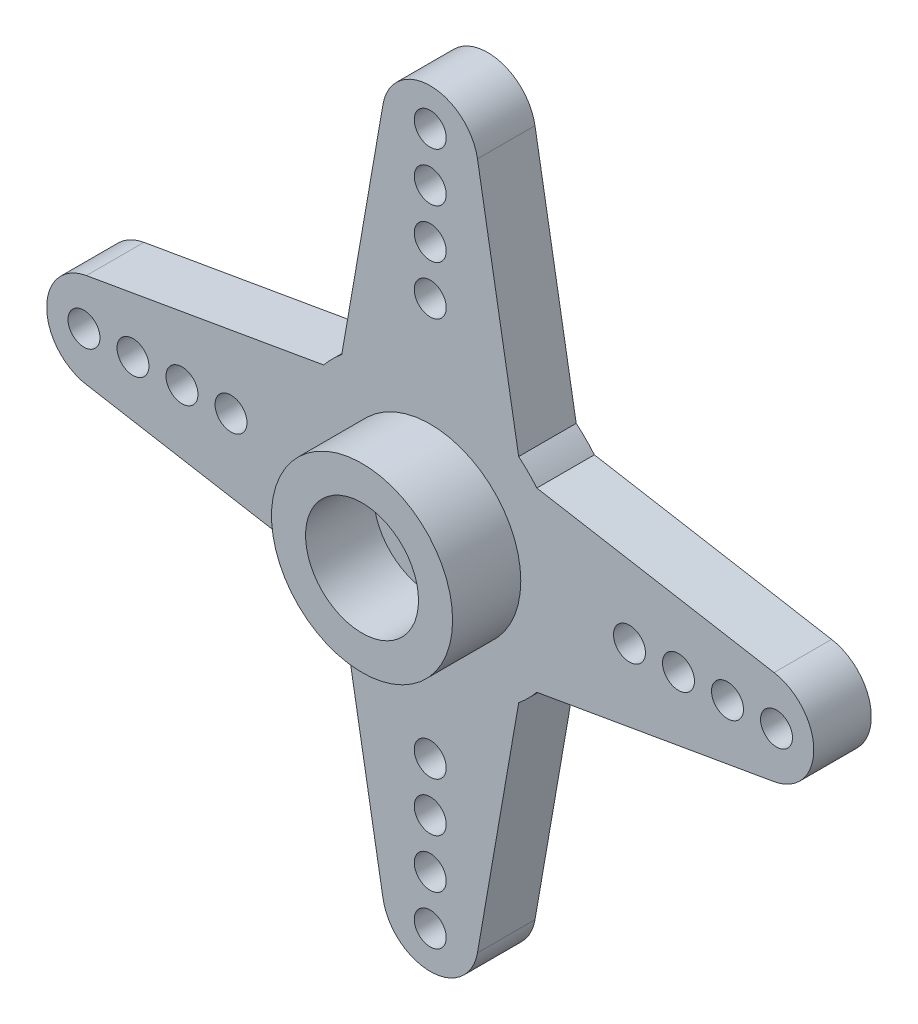
from build123d import *

# Parameters (mm, degrees)
ESBO_O1_R                = 0.75
ESBO_O1_R_2              = 1.5
RESSALTO_EXTRUS_O1_DEPTH = 2.7
PADR_OCIRCULAR1_COUNT    = 4
ESBO_O2_R                = 4.25
ESBO_O2_R_2              = 2.65
RESSALTO_EXTRUS_O2_DEPTH = 3.2
ESBO_O3_R                = 3.35
ESBO_O3_R_2              = 2.85
RESSALTO_EXTRUS_O3_DEPTH = 0.5


with BuildPart() as part:
    # Esboço1 → Ressalto-extrusão1 (new body)
    with BuildSketch(Plane.XY):
        with BuildLine():
            Line((-2.21682252, 16.134964821), (-4.15, 5.002749244))
            ThreePointArc((-4.15, 5.002749244), (0, -6.5), (4.15, 5.002749244))
            Line((4.15, 5.002749244), (2.21682252, 16.134964821))
            ThreePointArc((2.21682252, 16.134964821), (0, 18), (-2.21682252, 16.134964821))
        make_face()
        with Locations(Location((0, 16.25, 0), (0, 0, 180))):
            Circle(ESBO_O1_R, mode=Mode.SUBTRACT)
        with Locations(Location((0, 13.95, 0), (0, 0, 180))):
            Circle(ESBO_O1_R, mode=Mode.SUBTRACT)
        with Locations(Location((0, 11.65, 0), (0, 0, 180))):
            Circle(ESBO_O1_R, mode=Mode.SUBTRACT)
        with Locations(Location((0, 9.35, 0), (0, 0, 180))):
            Circle(ESBO_O1_R, mode=Mode.SUBTRACT)
        with Locations(Location((0, 0, 0), (0, 0, 180))):
            Circle(ESBO_O1_R_2, mode=Mode.SUBTRACT)
    ressalto_extrus_o1 = extrude(amount=RESSALTO_EXTRUS_O1_DEPTH)

    # PadrãoCircular1: Ressalto-extrusão1 ×4 about axis
    padr_ocircular1_axis = Axis((0, 0, 0), (0, 0, 1))
    for i in range(1, PADR_OCIRCULAR1_COUNT):
        add(ressalto_extrus_o1.rotate(padr_ocircular1_axis, i * 360 / PADR_OCIRCULAR1_COUNT))

    # Esboço2 → Ressalto-extrusão2 (add)
    with BuildSketch(Plane.XY.offset(2.7)):
        Circle(ESBO_O2_R)
        Circle(ESBO_O2_R_2, mode=Mode.SUBTRACT)
    extrude(amount=RESSALTO_EXTRUS_O2_DEPTH)

    # Esboço3 → Ressalto-extrusão3 (add)
    with BuildSketch(Plane(origin=(0, 0, 0), x_dir=(-1, 0, 0), z_dir=(0, 0, -1))):
        with Locations(Location((0, 0, 0), (0, 0, 180))):
            Circle(ESBO_O3_R)
        Circle(ESBO_O3_R_2, mode=Mode.SUBTRACT)
    extrude(amount=RESSALTO_EXTRUS_O3_DEPTH)


solid = part.part
